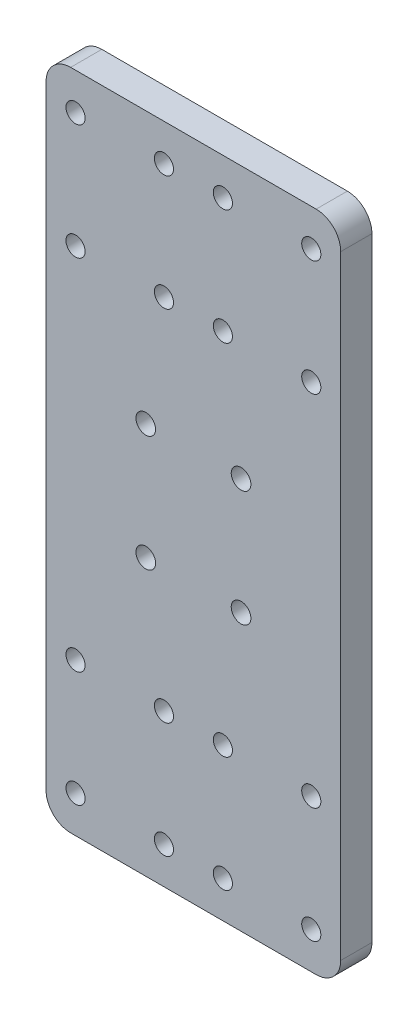
from build123d import *

# Parameters (mm, degrees)
SKETCH1_R           = 1.95
SKETCH1_R_2         = 2
BOSS_EXTRUDE1_DEPTH = 6.35


with BuildPart() as part:
    # Sketch1 → Boss-Extrude1 (new body)
    with BuildSketch(Plane.XY):
        with BuildLine():
            Line((-25, -67.5), (25, -67.5))
            ThreePointArc((25, -67.5), (28.535533906, -66.035533906), (30, -62.5))
            Line((30, -62.5), (30, 62.5))
            ThreePointArc((30, 62.5), (28.535533906, 66.035533906), (25, 67.5))
            Line((25, 67.5), (-25, 67.5))
            ThreePointArc((-25, 67.5), (-28.535533906, 66.035533906), (-30, 62.5))
            Line((-30, 62.5), (-30, -62.5))
            ThreePointArc((-30, -62.5), (-28.535533906, -66.035533906), (-25, -67.5))
        make_face()
        with Locations((24, 60)):
            Circle(SKETCH1_R, mode=Mode.SUBTRACT)
        with Locations((6, 60)):
            Circle(SKETCH1_R, mode=Mode.SUBTRACT)
        with Locations((6, 36.5)):
            Circle(SKETCH1_R, mode=Mode.SUBTRACT)
        with Locations((24, 36.5)):
            Circle(SKETCH1_R, mode=Mode.SUBTRACT)
        with Locations(Location((-6, 60, 0), (0, 0, 180))):
            Circle(SKETCH1_R, mode=Mode.SUBTRACT)
        with Locations(Location((-24, 60, 0), (0, 0, 180))):
            Circle(SKETCH1_R, mode=Mode.SUBTRACT)
        with Locations(Location((-24, 36.5, 0), (0, 0, 180))):
            Circle(SKETCH1_R, mode=Mode.SUBTRACT)
        with Locations(Location((-6, 36.5, 0), (0, 0, 180))):
            Circle(SKETCH1_R, mode=Mode.SUBTRACT)
        with Locations((-24, -36.5)):
            Circle(SKETCH1_R, mode=Mode.SUBTRACT)
        with Locations((-6, -36.5)):
            Circle(SKETCH1_R, mode=Mode.SUBTRACT)
        with Locations(Location((6, -36.5, 0), (0, 0, 180))):
            Circle(SKETCH1_R, mode=Mode.SUBTRACT)
        with Locations(Location((24, -36.5, 0), (0, 0, 180))):
            Circle(SKETCH1_R, mode=Mode.SUBTRACT)
        with Locations(Location((24, -60, 0), (0, 0, 180))):
            Circle(SKETCH1_R, mode=Mode.SUBTRACT)
        with Locations(Location((6, -60, 0), (0, 0, 180))):
            Circle(SKETCH1_R, mode=Mode.SUBTRACT)
        with Locations((-6, -60)):
            Circle(SKETCH1_R, mode=Mode.SUBTRACT)
        with Locations((-24, -60)):
            Circle(SKETCH1_R, mode=Mode.SUBTRACT)
        with Locations((9.7, -11.3)):
            Circle(SKETCH1_R_2, mode=Mode.SUBTRACT)
        with Locations((9.7, 12.3)):
            Circle(SKETCH1_R_2, mode=Mode.SUBTRACT)
        with Locations(Location((-9.7, -11.3, 0), (0, 0, 180))):
            Circle(SKETCH1_R_2, mode=Mode.SUBTRACT)
        with Locations(Location((-9.7, 12.3, 0), (0, 0, 180))):
            Circle(SKETCH1_R_2, mode=Mode.SUBTRACT)
    extrude(amount=BOSS_EXTRUDE1_DEPTH)


solid = part.part
